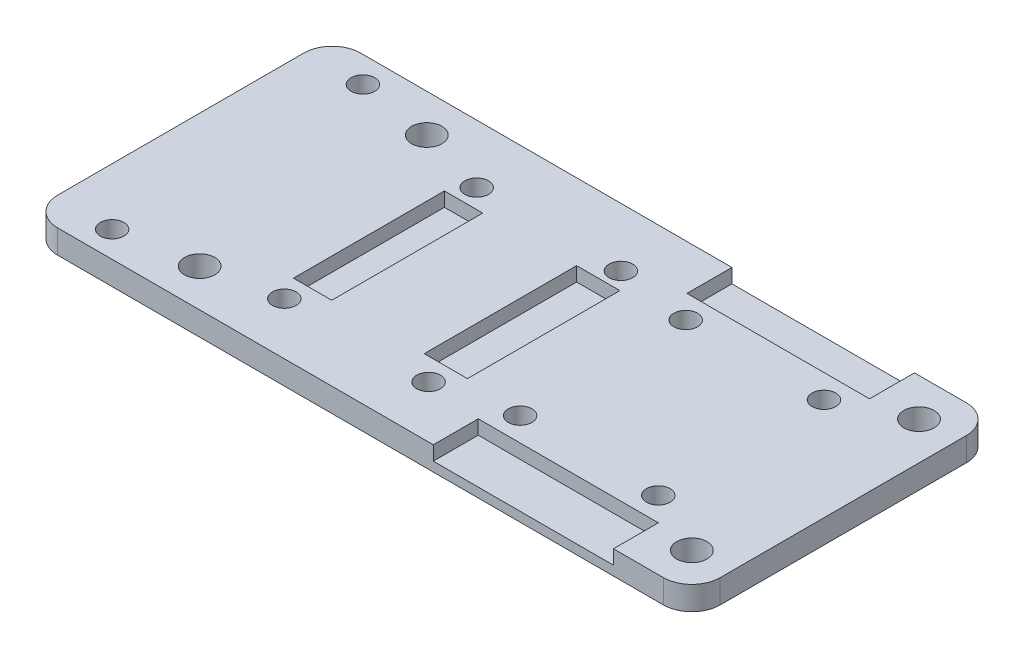
from build123d import *

# Parameters (mm, degrees)
SKETCH1_R           = 1.6
SKETCH1_R_2         = 1.25
BOSS_EXTRUDE1_DEPTH = 2.5
SKETCH4_W           = 4.046420923
SKETCH4_H           = 15.954838713
SKETCH4_W_2         = 4.570038916
SKETCH4_H_2         = 16.10433934
SKETCH4_W_3         = 19.288754193
SKETCH4_H_3         = 4.75
SKETCH4_W_4         = 19.033274005
CUT_EXTRUDE2_DEPTH  = 1.5
FILLET1_R           = 3


with BuildPart() as part:
    # Sketch1 → Boss-Extrude1 (new body)
    with BuildSketch(Plane(origin=(0, 0, 0), x_dir=(1, 0, 0), z_dir=(0, 1, 0))):
        Polygon((-30, -16), (30, -16), (30, 16), (-30, 16), (-40, 16), (-40, -16), align=None)
        with Locations(Location((-26, 12, 0), (0, 0, 270))):
            Circle(SKETCH1_R, mode=Mode.SUBTRACT)
        with Locations(Location((26, 12, 0), (0, 0, 270))):
            Circle(SKETCH1_R, mode=Mode.SUBTRACT)
        with Locations(Location((26, -12, 0), (0, 0, 270))):
            Circle(SKETCH1_R, mode=Mode.SUBTRACT)
        with Locations(Location((-26, -12, 0), (0, 0, 270))):
            Circle(SKETCH1_R, mode=Mode.SUBTRACT)
        with Locations(Location((-18.554722835, 9.82, 0), (0, 0, 270))):
            Circle(SKETCH1_R_2, mode=Mode.SUBTRACT)
        with Locations(Location((-3.314722835, 9.82, 0), (0, 0, 270))):
            Circle(SKETCH1_R_2, mode=Mode.SUBTRACT)
        with Locations(Location((-3.314722835, -10.5, 0), (0, 0, 270))):
            Circle(SKETCH1_R_2, mode=Mode.SUBTRACT)
        with Locations(Location((-18.554722835, -10.5, 0), (0, 0, 270))):
            Circle(SKETCH1_R_2, mode=Mode.SUBTRACT)
        with Locations(Location((4.60621428, 8.75, 0), (0, 0, 270))):
            Circle(SKETCH1_R_2, mode=Mode.SUBTRACT)
        with Locations(Location((19.20621428, 8.75, 0), (0, 0, 270))):
            Circle(SKETCH1_R_2, mode=Mode.SUBTRACT)
        with Locations(Location((19.20621428, -8.75, 0), (0, 0, 270))):
            Circle(SKETCH1_R_2, mode=Mode.SUBTRACT)
        with Locations(Location((4.60621428, -8.75, 0), (0, 0, 270))):
            Circle(SKETCH1_R_2, mode=Mode.SUBTRACT)
        with Locations(Location((-34, 13.25, 0), (0, 0, 270))):
            Circle(SKETCH1_R_2, mode=Mode.SUBTRACT)
        with Locations(Location((-34, -13.25, 0), (0, 0, 270))):
            Circle(SKETCH1_R_2, mode=Mode.SUBTRACT)
    extrude(amount=BOSS_EXTRUDE1_DEPTH)

    # Sketch4 → Cut-Extrude2 (cut)
    with BuildSketch(Plane(origin=(0, 2.5, 0), x_dir=(1, 0, 0), z_dir=(0, 1, 0))):
        with Locations((-17.926852164, -0.166011636)):
            Rectangle(SKETCH4_W, SKETCH4_H)
        with Locations((-3.846505054, -0.091261322)):
            Rectangle(SKETCH4_W_2, SKETCH4_H_2)
        with Locations((11.879828742, 13.625)):
            Rectangle(SKETCH4_W_3, SKETCH4_H_3)
        with Locations((12.199178977, -13.625)):
            Rectangle(SKETCH4_W_4, SKETCH4_H_3)
    extrude(amount=-CUT_EXTRUDE2_DEPTH, mode=Mode.SUBTRACT)

    # Fillet1
    fillet1_edges = [part.edges().sort_by_distance(p)[0] for p in [
        (30, 1.25, 16),
        (-40, 1.25, 16),
        (-40, 1.25, -16),
        (30, 1.25, -16),
    ]]
    fillet(fillet1_edges, radius=FILLET1_R)


solid = part.part
